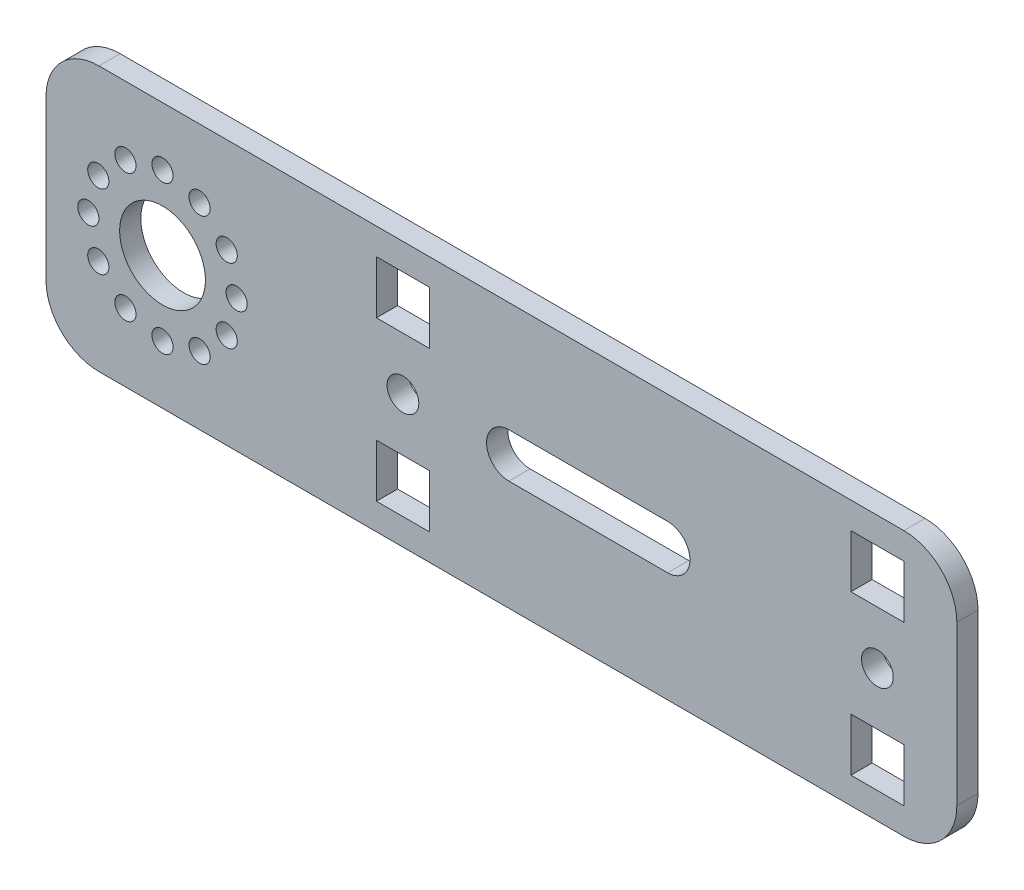
from build123d import *

# Parameters (mm, degrees)
ESQUISSE2_W        = 86
ESQUISSE2_H        = 25
ESQUISSE2_R        = 4.05
ESQUISSE2_R_2      = 1
ESQUISSE2_R_3      = 1.5
ESQUISSE2_W_2      = 5
ESQUISSE2_H_2      = 5
BOSS_EXTRU_1_DEPTH = 2
CONG_1_R           = 5


with BuildPart() as part:
    # Esquisse2 → Boss.-Extru.1 (new body)
    with BuildSketch(Plane(origin=(0, 0, 0), x_dir=(-1, 0, 0), z_dir=(0, 0, -1))):
        with Locations((-43, 0)):
            Rectangle(ESQUISSE2_W, ESQUISSE2_H)
        with Locations((-11, 0)):
            Circle(ESQUISSE2_R, mode=Mode.SUBTRACT)
        with Locations((-4, 0)):
            Circle(ESQUISSE2_R_2, mode=Mode.SUBTRACT)
        with Locations((-4.937822174, -3.5)):
            Circle(ESQUISSE2_R_2, mode=Mode.SUBTRACT)
        with Locations((-7.5, -6.062177826)):
            Circle(ESQUISSE2_R_2, mode=Mode.SUBTRACT)
        with Locations((-11, -7)):
            Circle(ESQUISSE2_R_2, mode=Mode.SUBTRACT)
        with Locations((-14.5, -6.062177826)):
            Circle(ESQUISSE2_R_2, mode=Mode.SUBTRACT)
        with Locations((-17.062177826, -3.5)):
            Circle(ESQUISSE2_R_2, mode=Mode.SUBTRACT)
        with Locations((-18, 0)):
            Circle(ESQUISSE2_R_2, mode=Mode.SUBTRACT)
        with Locations((-17.062177826, 3.5)):
            Circle(ESQUISSE2_R_2, mode=Mode.SUBTRACT)
        with Locations((-14.5, 6.062177826)):
            Circle(ESQUISSE2_R_2, mode=Mode.SUBTRACT)
        with Locations((-11, 7)):
            Circle(ESQUISSE2_R_2, mode=Mode.SUBTRACT)
        with Locations((-7.5, 6.062177826)):
            Circle(ESQUISSE2_R_2, mode=Mode.SUBTRACT)
        with Locations((-4.937822174, 3.5)):
            Circle(ESQUISSE2_R_2, mode=Mode.SUBTRACT)
        with Locations((-78.5, 0)):
            Circle(ESQUISSE2_R_3, mode=Mode.SUBTRACT)
        with Locations((-33.7, 0)):
            Circle(ESQUISSE2_R_3, mode=Mode.SUBTRACT)
        with BuildLine():
            Line((-43.7, -2.1), (-58.7, -2.1))
            ThreePointArc((-58.7, -2.1), (-60.8, 0), (-58.7, 2.1))
            Line((-58.7, 2.1), (-43.7, 2.1))
            ThreePointArc((-43.7, 2.1), (-41.6, 0), (-43.7, -2.1))
        make_face(mode=Mode.SUBTRACT)
        with Locations((-78.5, -7.5)):
            Rectangle(ESQUISSE2_W_2, ESQUISSE2_H_2, mode=Mode.SUBTRACT)
        with Locations((-78.5, 7.5)):
            Rectangle(ESQUISSE2_W_2, ESQUISSE2_H_2, mode=Mode.SUBTRACT)
        with Locations((-33.7, -7.5)):
            Rectangle(ESQUISSE2_W_2, ESQUISSE2_H_2, mode=Mode.SUBTRACT)
        with Locations((-33.7, 7.5)):
            Rectangle(ESQUISSE2_W_2, ESQUISSE2_H_2, mode=Mode.SUBTRACT)
    extrude(amount=-BOSS_EXTRU_1_DEPTH)

    # Congé1
    cong_1_edges = [part.edges().sort_by_distance(p)[0] for p in [
        (86, 12.5, 1),
        (0, 12.5, 1),
        (0, -12.5, 1),
        (86, -12.5, 1),
    ]]
    fillet(cong_1_edges, radius=CONG_1_R)


solid = part.part
